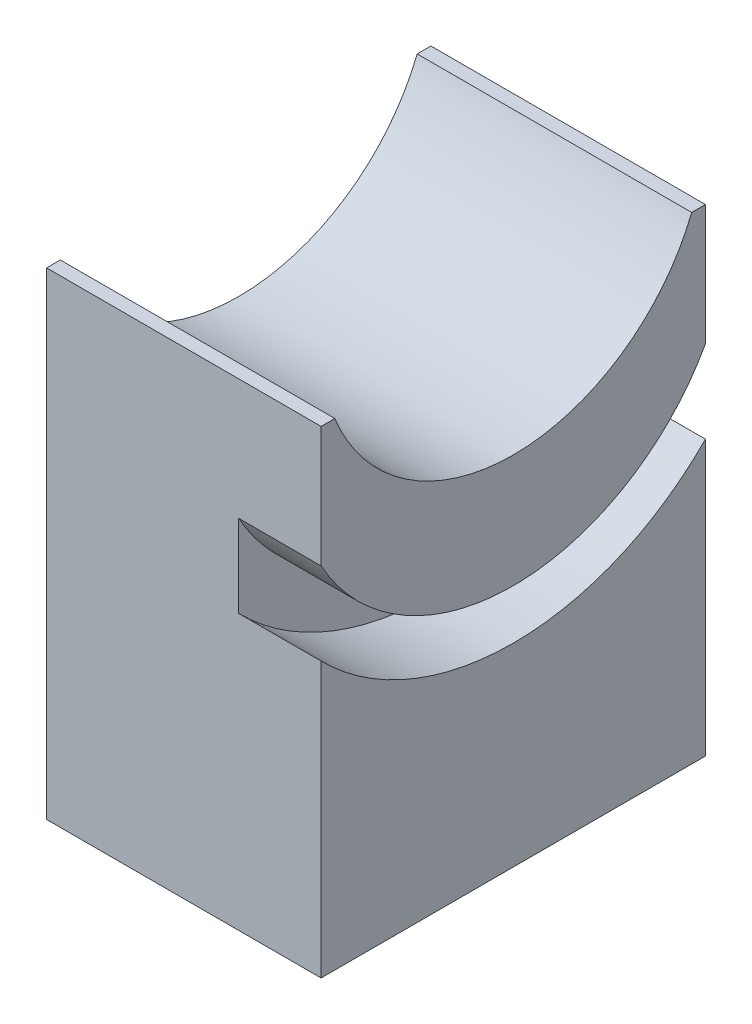
from build123d import *

# Parameters (mm, degrees)
BOSS_EXTRUDE2_DEPTH = 20
CUT_EXTRUDE1_DEPTH  = 6


with BuildPart() as part:
    # Sketch1 → Boss-Extrude2 (new body)
    with BuildSketch(Plane(origin=(0, 0, 0), x_dir=(0, 0, -1), z_dir=(1, 0, 0))):
        with BuildLine():
            Line((0, 0), (-28, 0))
            Line((-28, 0), (-28, 34.803847577))
            Line((-28, 34.803847577), (-27, 34.803847577))
            ThreePointArc((-27, 34.803847577), (-14, 26), (-1, 34.803847577))
            Line((-1, 34.803847577), (0, 34.803847577))
            Line((0, 34.803847577), (0, 0))
        make_face()
    extrude(amount=-BOSS_EXTRUDE2_DEPTH)

    # Sketch3 → Cut-Extrude1 (cut)
    with BuildSketch(Plane(origin=(0, 0, 0), x_dir=(0, 0, -1), z_dir=(1, 0, 0))):
        with BuildLine():
            Line((-28, 20), (-28, 26))
            ThreePointArc((-28, 26), (-14, 17.745966692), (0, 26))
            Line((0, 26), (0, 20))
            ThreePointArc((0, 20), (-14, 14.125783199), (-28, 20))
        make_face()
    extrude(amount=-CUT_EXTRUDE1_DEPTH, mode=Mode.SUBTRACT)


solid = part.part
